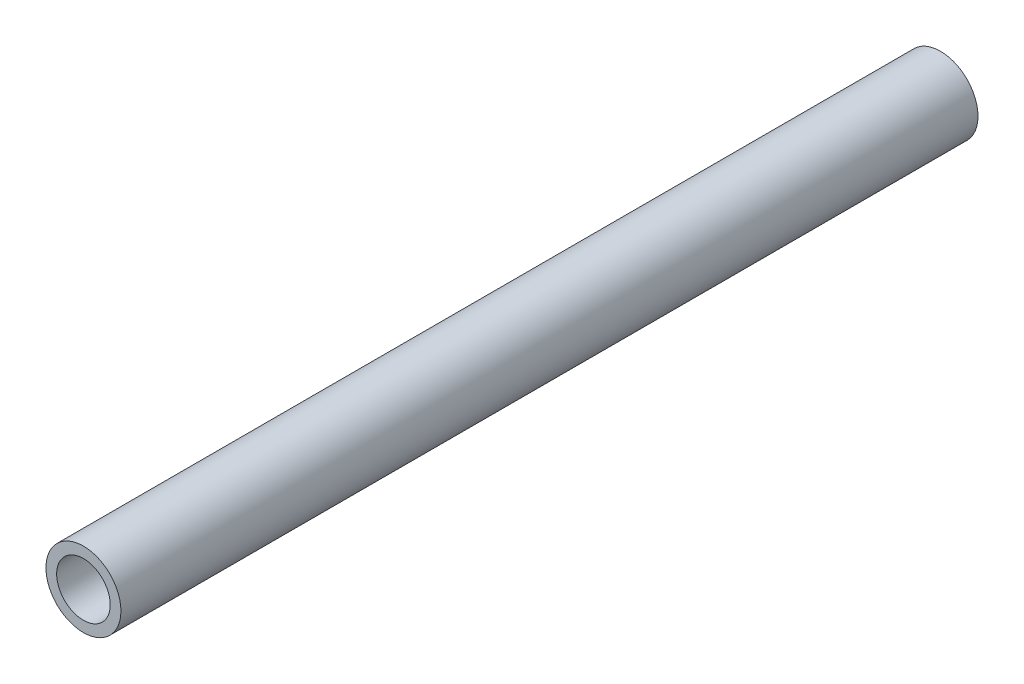
from build123d import *

# Parameters (mm, degrees)
SKETCH1_R           = 3.5
SKETCH1_R_2         = 2.5
BOSS_EXTRUDE1_DEPTH = 80


with BuildPart() as part:
    # Sketch1 → Boss-Extrude1 (new body)
    with BuildSketch(Plane.XY):
        with Locations((0, 457.253610621)):
            Circle(SKETCH1_R)
        with Locations((0, 457.253610621)):
            Circle(SKETCH1_R_2, mode=Mode.SUBTRACT)
    extrude(amount=-BOSS_EXTRUDE1_DEPTH)


solid = part.part
